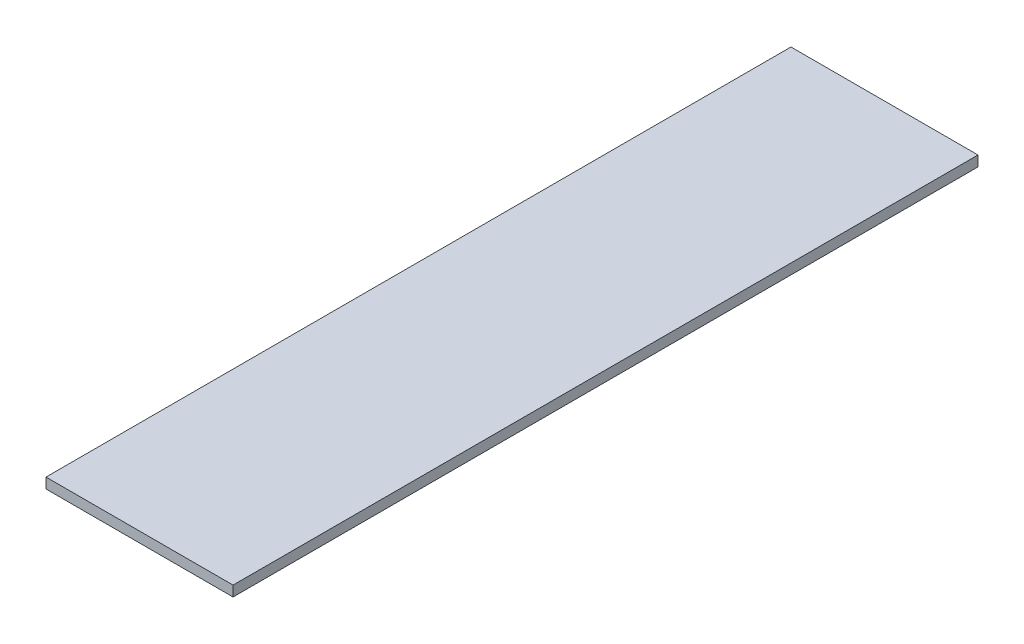
from build123d import *

# Parameters (mm, degrees)
SKETCH1_W          = 57.404
SKETCH1_H          = 228.6
BASE_EXTRUDE_DEPTH = 3.175


with BuildPart() as part:
    # Sketch1 → Base extrude (new body)
    with BuildSketch(Plane(origin=(0, 0, 0), x_dir=(1, 0, 0), z_dir=(0, 1, 0))):
        with Locations((28.702, 114.3)):
            Rectangle(SKETCH1_W, SKETCH1_H)
    extrude(amount=BASE_EXTRUDE_DEPTH)


solid = part.part
